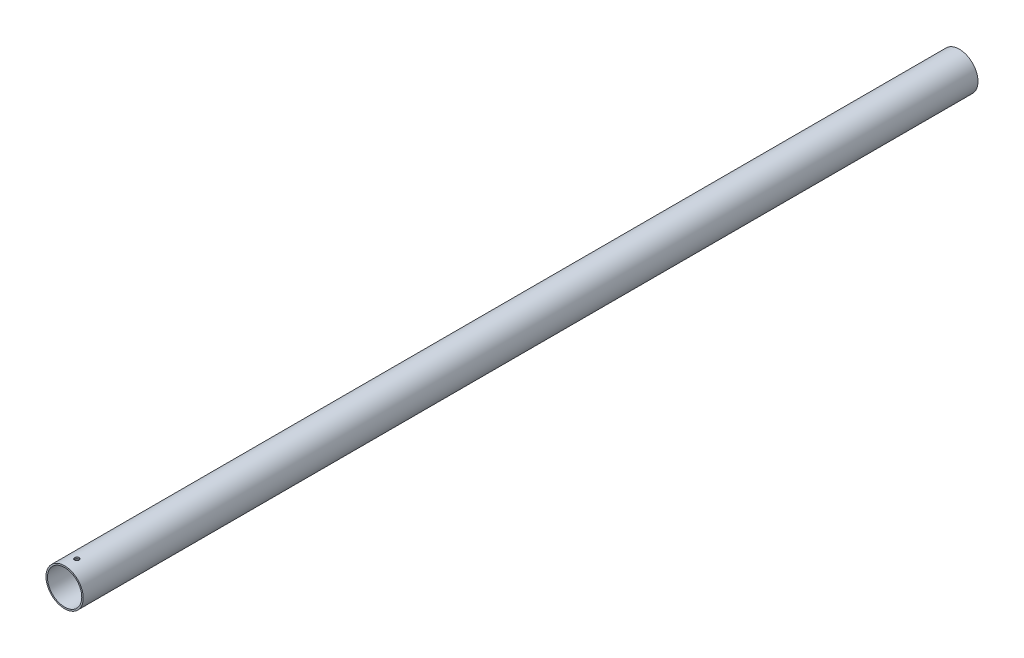
from build123d import *

# Parameters (mm, degrees)
ESQUISSE1_R             = 12.5
ESQUISSE1_R_2           = 11.5
BOSS_EXTRU_1_DEPTH      = 600
ESQUISSE2_R             = 1.5
ENL_V_MAT_EXTRU_1_DEPTH = 601.260360177


with BuildPart() as part:
    # Esquisse1 → Boss.-Extru.1 (new body)
    with BuildSketch(Plane.XY):
        Circle(ESQUISSE1_R)
        Circle(ESQUISSE1_R_2, mode=Mode.SUBTRACT)
    extrude(amount=BOSS_EXTRU_1_DEPTH)

    # Esquisse2 → Enlèv. mat.-Extru.1 (cut, through all)
    with BuildSketch(Plane(origin=(0, 0, 0), x_dir=(1, 0, 0), z_dir=(0, 1, 0))):
        with Locations(Location((0, -591.85, 0), (0, 0, 90))):
            Circle(ESQUISSE2_R)
    extrude(amount=ENL_V_MAT_EXTRU_1_DEPTH, mode=Mode.SUBTRACT)


solid = part.part
